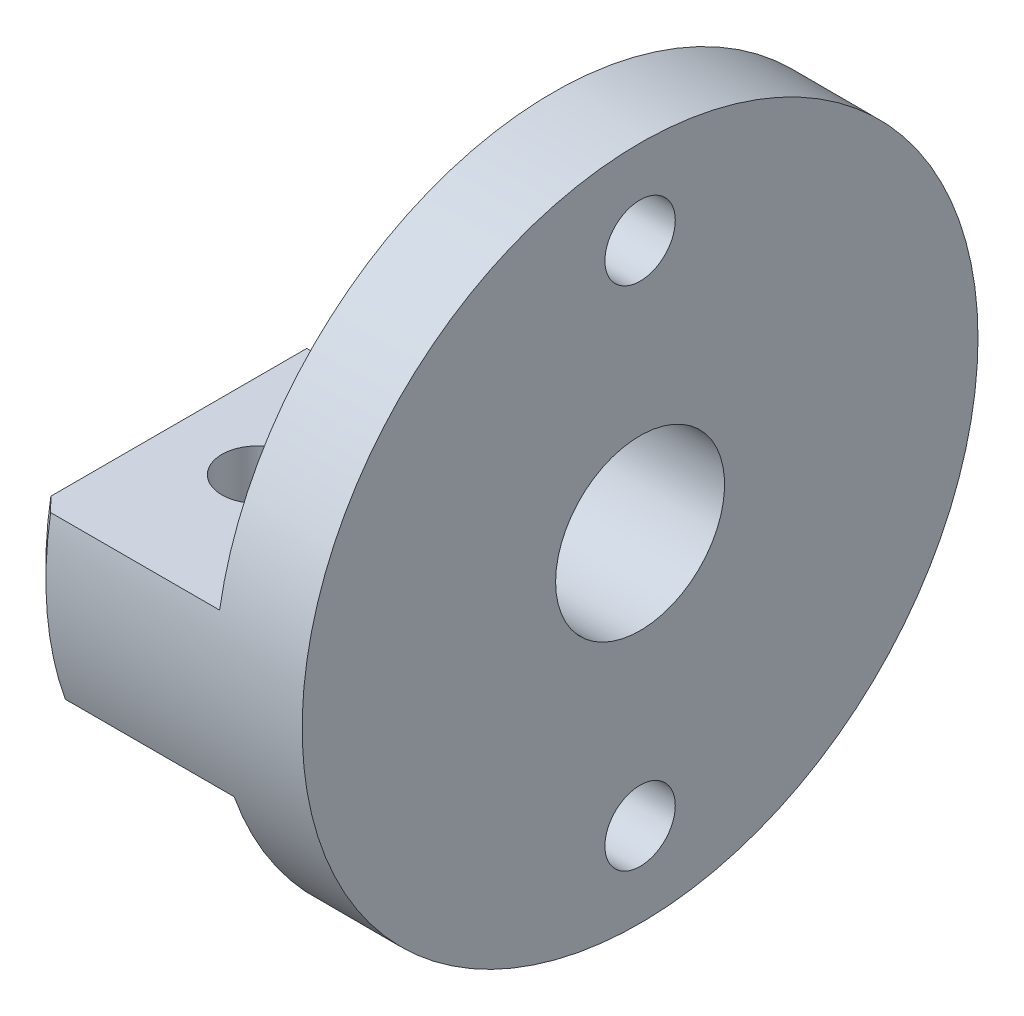
from build123d import *

# Parameters (mm, degrees)
SKETCH_1_R          = 12
EXTRUDE_1_DEPTH     = 6
SKETCH_2_R          = 12
EXTRUDE_2_DEPTH     = 3.6
SKETCH_3_R          = 3
CUT_EXTRUDE_1_DEPTH = 20.497692171
CUT_EXTRUDE_2_DEPTH = 6
CHAMFER_1_SIZE      = 0.5
SKETCH_5_R          = 1.25
CUT_EXTRUDE_3_DEPTH = 23.184679398
CUT_EXTRUDE_7_DEPTH = 0.5
SKETCH_13_R         = 1.25
CUT_EXTRUDE_8_DEPTH = 23.184679398
SKETCH_8_R          = 1.25
CUT_EXTRUDE_9_DEPTH = 20.49769222


with BuildPart() as part:
    # 草图1 → 凸台-拉伸1 (new body)
    with BuildSketch(Plane(origin=(0, 0, 0), x_dir=(0, 0, -1), z_dir=(1, 0, 0))):
        Circle(SKETCH_1_R)
    extrude(amount=EXTRUDE_1_DEPTH)

    # 草图2 → 凸台-拉伸2 (add)
    with BuildSketch(Plane(origin=(6, 0, 0), x_dir=(0, 0, -1), z_dir=(1, 0, 0))):
        Circle(SKETCH_2_R)
    extrude(amount=EXTRUDE_2_DEPTH)

    # 草图3 → 切除-拉伸1 (cut, through all)
    with BuildSketch(Plane.ZY):
        Circle(SKETCH_3_R)
    extrude(amount=-CUT_EXTRUDE_1_DEPTH, mode=Mode.SUBTRACT)

    # 草图4 → 切除-拉伸2 (cut)
    with BuildSketch(Plane.ZY):
        with BuildLine():
            Line((-11.832159566, 2), (11.832159566, 2))
            ThreePointArc((11.832159566, 2), (0, 12), (-11.832159566, 2))
        make_face()
        with BuildLine():
            Line((11.313708499, -4), (-11.313708499, -4))
            ThreePointArc((-11.313708499, -4), (0, -12), (11.313708499, -4))
        make_face()
    extrude(amount=-CUT_EXTRUDE_2_DEPTH, mode=Mode.SUBTRACT)

    # 倒角1
    chamfer_1_edges = [part.edges().sort_by_distance(p)[0] for p in [
        (0, -1.033052698, 11.955450729),
        (0, -2.029223745, -11.827182716),
    ]]
    chamfer(chamfer_1_edges, length=CHAMFER_1_SIZE)

    # 草图5 → 切除-拉伸3 (cut, through all)
    with BuildSketch(Plane.XZ.offset(4)):
        with Locations(Location((3, -7, 0), (0, 0, 270))):
            Circle(SKETCH_5_R)
        with Locations(Location((3, 7, 0), (0, 0, 270))):
            Circle(SKETCH_5_R)
    extrude(amount=-CUT_EXTRUDE_3_DEPTH, mode=Mode.SUBTRACT)

    # 草图12 → 切除-拉伸7 (cut)
    with BuildSketch(Plane.ZY.offset(-6)):
        with BuildLine():
            Line((11.313708499, -4), (-11.313708499, -4))
            ThreePointArc((-11.313708499, -4), (0, -12), (11.313708499, -4))
        make_face()
        with BuildLine():
            Line((2.236067977, 2), (11.832159566, 2))
            ThreePointArc((11.832159566, 2), (0, 12), (-11.832159566, 2))
            Line((-11.832159566, 2), (-2.236067977, 2))
            ThreePointArc((-2.236067977, 2), (0, 3), (2.236067977, 2))
        make_face()
    extrude(amount=-CUT_EXTRUDE_7_DEPTH, mode=Mode.SUBTRACT)

    # 草图13 → 切除-拉伸8 (cut, through all)
    with BuildSketch(Plane(origin=(0, -4, 0), x_dir=(-1, 0, 0), z_dir=(0, -1, 0))):
        with Locations(Location((-2.6, 0, 0), (0, 0, 90))):
            Circle(SKETCH_13_R)
    extrude(amount=-CUT_EXTRUDE_8_DEPTH, mode=Mode.SUBTRACT)

    # 草图8 → 切除-拉伸9 (cut, through all)
    with BuildSketch(Plane(origin=(9.6, 0, 0), x_dir=(0, 0, -1), z_dir=(1, 0, 0))):
        with Locations((0, 9)):
            Circle(SKETCH_8_R)
        with Locations((0, -9)):
            Circle(SKETCH_8_R)
    extrude(amount=-CUT_EXTRUDE_9_DEPTH, mode=Mode.SUBTRACT)


solid = part.part
